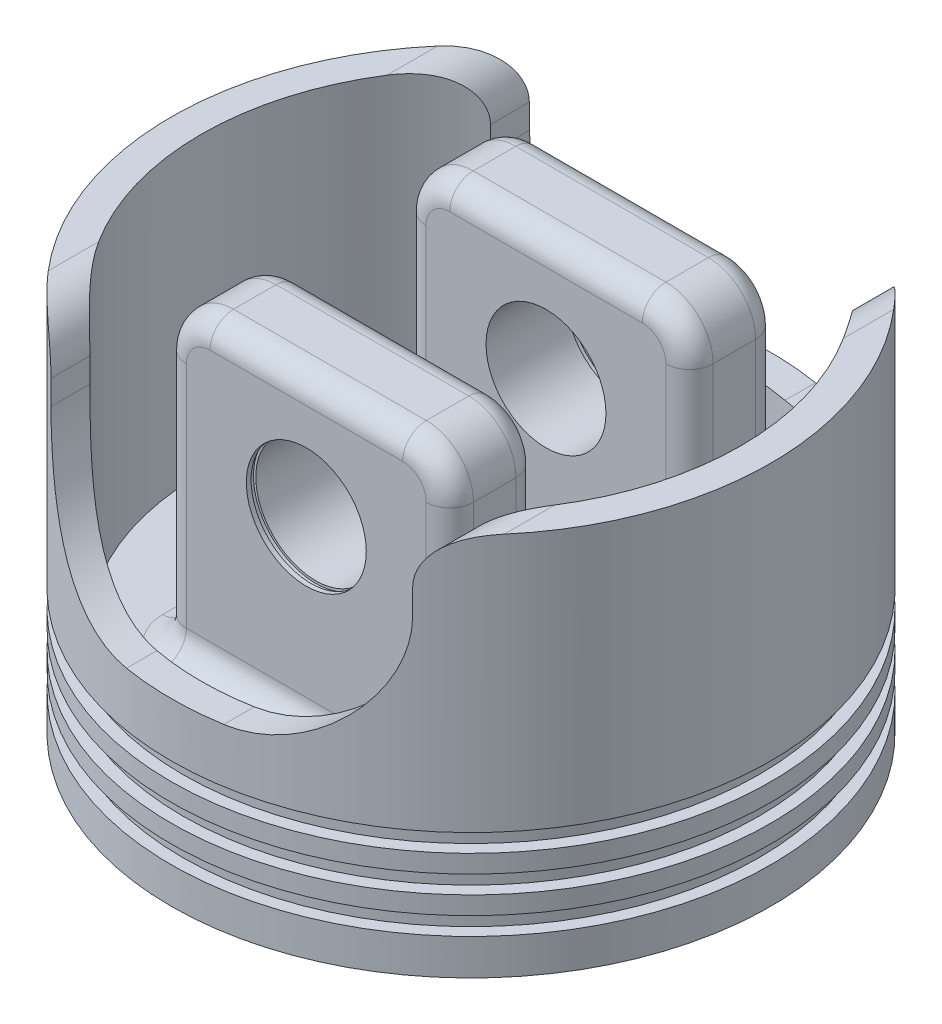
from build123d import *

# Parameters (mm, degrees)
SZKIC1_R                    = 63.5
DODANIE_WYCI_GNI_CIE2_DEPTH = 81.28
SZKIC2_R                    = 57.15
WYTNIJ_WYCI_GNI_CIE1_DEPTH  = 62.28
WYTNIJ_WYCI_GNI_CIE2_DEPTH  = 100
WYTNIJ_WYCI_GNI_CIE3_START  = -7.62
SZKIC5_R                    = 63.5
SZKIC5_R_2                  = 60.96
WYTNIJ_WYCI_GNI_CIE3_DEPTH  = 3.81
WYTNIJ_WYCI_GNI_CIE5_START  = -3.81
SZKIC6_R                    = 63.5
SZKIC6_R_2                  = 60.96
WYTNIJ_WYCI_GNI_CIE5_DEPTH  = 3.81
WYTNIJ_WYCI_GNI_CIE6_START  = 7.62
SZKIC7_R                    = 63.5
SZKIC7_R_2                  = 60.96
WYTNIJ_WYCI_GNI_CIE6_DEPTH  = 3.81
SZKIC8_W                    = 60.8
SZKIC8_H                    = 19
DODANIE_WYCI_GNI_CIE3_DEPTH = 63.5
SZKIC9_R                    = 12.7
WYTNIJ_WYCI_GNI_CIE7_DEPTH  = 144.237999261
ZAOKR_GLENIE3_R             = 10
ZAOKR_GLENIE4_R             = 5
ZAOKR_GLENIE5_R             = 5
WYTNIJ_WYCI_GNI_CIE8_START  = -1
SZKIC10_R                   = 13.2
SZKIC10_R_2                 = 12.7
WYTNIJ_WYCI_GNI_CIE8_DEPTH  = 1


with BuildPart() as part:
    # Szkic1 → Dodanie-wyciągnięcie2 (new body)
    with BuildSketch(Plane(origin=(0, 0, 0), x_dir=(1, 0, 0), z_dir=(0, 1, 0))):
        with Locations(Location((0, 0, 0), (0, 0, 270))):
            Circle(SZKIC1_R)
    extrude(amount=DODANIE_WYCI_GNI_CIE2_DEPTH)

    # Szkic2 → Wytnij-wyciągnięcie1 (cut)
    with BuildSketch(Plane(origin=(0, 81.28, 0), x_dir=(1, 0, 0), z_dir=(0, 1, 0))):
        with Locations(Location((0, 0, 0), (0, 0, 270))):
            Circle(SZKIC2_R)
    extrude(amount=-WYTNIJ_WYCI_GNI_CIE1_DEPTH, mode=Mode.SUBTRACT)

    # Szkic3 → Wytnij-wyciągnięcie2 (cut, symmetric)
    with BuildSketch(Plane.XY):
        with BuildLine():
            Line((-63.5, 81.28), (-63.5, 87.00412987))
            Line((-63.5, 87.00412987), (63.5, 87.00412987))
            Line((63.5, 87.00412987), (63.5, 81.28))
            Line((63.5, 81.28), (48.3, 81.28))
            ThreePointArc((48.3, 81.28), (41.228932188, 78.351067812), (38.3, 71.28))
            Line((38.3, 71.28), (38.3, 66.1))
            ThreePointArc((38.3, 66.1), (30.098989873, 46.301010127), (10.3, 38.1))
            Line((10.3, 38.1), (-10.3, 38.1))
            ThreePointArc((-10.3, 38.1), (-30.098989873, 46.301010127), (-38.3, 66.1))
            Line((-38.3, 66.1), (-38.3, 71.28))
            ThreePointArc((-38.3, 71.28), (-41.228932188, 78.351067812), (-48.3, 81.28))
            Line((-48.3, 81.28), (-63.5, 81.28))
        make_face()
    extrude(amount=WYTNIJ_WYCI_GNI_CIE2_DEPTH, both=True, mode=Mode.SUBTRACT)

    # Szkic5 → Wytnij-wyciągnięcie3 (cut)
    with BuildSketch(Plane(origin=(0, 0, 0), x_dir=(-1, 0, 0), z_dir=(0, -1, 0)).offset(WYTNIJ_WYCI_GNI_CIE3_START)):
        with Locations(Location((0, 0, 0), (0, 0, 90))):
            Circle(SZKIC5_R)
        with Locations(Location((0, 0, 0), (0, 0, 90))):
            Circle(SZKIC5_R_2, mode=Mode.SUBTRACT)
    extrude(amount=-WYTNIJ_WYCI_GNI_CIE3_DEPTH, mode=Mode.SUBTRACT)

    # Szkic6 → Wytnij-wyciągnięcie5 (cut)
    with BuildSketch(Plane(origin=(0, 11.43, 0), x_dir=(-1, 0, 0), z_dir=(0, -1, 0)).offset(WYTNIJ_WYCI_GNI_CIE5_START)):
        with Locations(Location((0, 0, 0), (0, 0, 90))):
            Circle(SZKIC6_R)
        with Locations(Location((0, 0, 0), (0, 0, 90))):
            Circle(SZKIC6_R_2, mode=Mode.SUBTRACT)
    extrude(amount=-WYTNIJ_WYCI_GNI_CIE5_DEPTH, mode=Mode.SUBTRACT)

    # Szkic7 → Wytnij-wyciągnięcie6 (cut)
    with BuildSketch(Plane(origin=(0, 15.24, 0), x_dir=(1, 0, 0), z_dir=(0, 1, 0)).offset(WYTNIJ_WYCI_GNI_CIE6_START)):
        with Locations(Location((0, 0, 0), (0, 0, 90))):
            Circle(SZKIC7_R)
        with Locations(Location((0, 0, 0), (0, 0, 90))):
            Circle(SZKIC7_R_2, mode=Mode.SUBTRACT)
    extrude(amount=WYTNIJ_WYCI_GNI_CIE6_DEPTH, mode=Mode.SUBTRACT)

    # Szkic8 → Dodanie-wyciągnięcie3 (add)
    with BuildSketch(Plane(origin=(0, 19, 0), x_dir=(1, 0, 0), z_dir=(0, 1, 0))):
        with Locations((0, 25.38)):
            Rectangle(SZKIC8_W, SZKIC8_H)
        with Locations((0, -25.38)):
            Rectangle(SZKIC8_W, SZKIC8_H)
    extrude(amount=DODANIE_WYCI_GNI_CIE3_DEPTH)

    # Szkic9 → Wytnij-wyciągnięcie7 (cut, through all)
    with BuildSketch(Plane.XY.offset(34.88)):
        with Locations((0, 57.1)):
            Circle(SZKIC9_R)
    extrude(amount=-WYTNIJ_WYCI_GNI_CIE7_DEPTH, mode=Mode.SUBTRACT)

    # Zaokrąglenie3
    zaokr_glenie3_edges = [part.edges().sort_by_distance(p)[0] for p in [
        (30.4, 82.5, -25.38),
        (-30.4, 82.5, -25.38),
        (30.4, 82.5, 25.38),
        (-30.4, 82.5, 25.38),
    ]]
    fillet(zaokr_glenie3_edges, radius=ZAOKR_GLENIE3_R)

    # Zaokrąglenie4
    zaokr_glenie4_edges = [part.edges().sort_by_distance(p)[0] for p in [
        (0, 82.5, -34.88),
        (0, 82.5, -15.88),
        (30.4, 45.75, -15.88),
        (-30.4, 45.75, -15.88),
        (27.471067812, 79.571067812, -15.88),
        (-27.471067812, 79.571067812, -15.88),
        (-30.4, 45.75, -34.88),
        (30.4, 45.75, -34.88),
        (27.471067812, 79.571067812, -34.88),
        (-27.471067812, 79.571067812, -34.88),
        (0, 82.5, 15.88),
        (0, 82.5, 34.88),
        (-30.4, 45.75, 15.88),
        (30.4, 45.75, 15.88),
        (-27.471067812, 79.571067812, 15.88),
        (27.471067812, 79.571067812, 15.88),
        (30.4, 45.75, 34.88),
        (-30.4, 45.75, 34.88),
        (-27.471067812, 79.571067812, 34.88),
        (27.471067812, 79.571067812, 34.88),
    ]]
    fillet(zaokr_glenie4_edges, radius=ZAOKR_GLENIE4_R)

    # Zaokrąglenie5
    zaokr_glenie5_edges = [part.edges().sort_by_distance(p)[0] for p in [
        (0, 19, -34.88),
        (30.4, 19, -25.38),
        (-30.4, 19, -25.38),
        (0, 19, -15.88),
        (0, 19, 34.88),
        (-30.4, 19, 25.38),
        (30.4, 19, 25.38),
        (0, 19, 15.88),
        (28.935533906, 19, -33.415533906),
        (-28.935533906, 19, -33.415533906),
        (-28.935533906, 19, -17.344466094),
        (28.935533906, 19, -17.344466094),
        (-28.935533906, 19, 33.415533906),
        (28.935533906, 19, 33.415533906),
        (28.935533906, 19, 17.344466094),
        (-28.935533906, 19, 17.344466094),
    ]]
    fillet(zaokr_glenie5_edges, radius=ZAOKR_GLENIE5_R)

    # Szkic10 → Wytnij-wyciągnięcie8 (cut)
    with BuildSketch(Plane.XY.offset(34.88).offset(WYTNIJ_WYCI_GNI_CIE8_START)):
        with Locations((0, 57.1)):
            Circle(SZKIC10_R)
        with Locations((0, 57.1)):
            Circle(SZKIC10_R_2, mode=Mode.SUBTRACT)
    wytnij_wyci_gni_cie8 = extrude(amount=-WYTNIJ_WYCI_GNI_CIE8_DEPTH, mode=Mode.SUBTRACT)

    # Lustro1: Wytnij-wyciągnięcie8 across plane
    add(wytnij_wyci_gni_cie8.mirror(Plane.XY), mode=Mode.SUBTRACT)


solid = part.part
